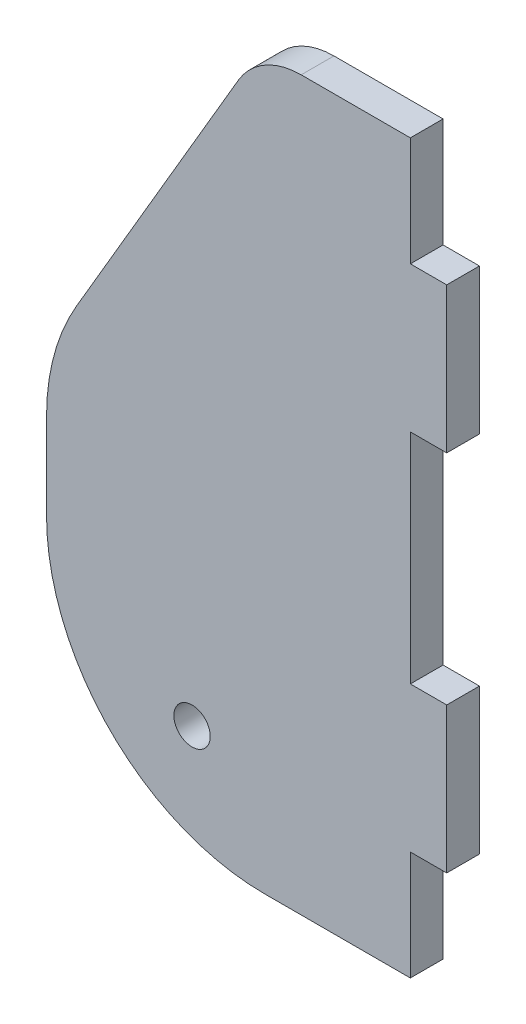
from build123d import *

# Parameters (mm, degrees)
BOSS_EXTRUDE1_DEPTH = 4.5
FILLET1_R           = 10
BOSS_EXTRUDE2_DEPTH = 4.5
FILLET2_R           = 30
SKETCH3_R           = 2.5
CUT_EXTRUDE1_DEPTH  = 5


with BuildPart() as part:
    # Sketch1 → Boss-Extrude1 (new body)
    with BuildSketch(Plane.XY):
        Polygon((10, -15), (10, 0), (10, 15), (15, 15), (15, 35), (10, 35), (10, 50), (-15, 50), (-15, -50), (10, -50), (10, -35), (15, -35), (15, -15), align=None)
    extrude(amount=BOSS_EXTRUDE1_DEPTH)

    # Fillet1
    fillet1_edges = [part.edges().sort_by_distance(p)[0] for p in [
        (-15, -50, 2.25),
        (-15, 50, 2.25),
    ]]
    fillet(fillet1_edges, radius=FILLET1_R)

    # Sketch2 → Boss-Extrude2 (add)
    with BuildSketch(Plane.XY.offset(4.5)):
        with BuildLine():
            Line((-40, 0), (-13.630305493, 45.051517306))
            ThreePointArc((-13.630305493, 45.051517306), (-14.651503897, 42.616958642), (-15, 40))
            Line((-15, 40), (-15, -40))
            ThreePointArc((-15, -40), (-12.071067812, -47.071067812), (-5, -50))
            Line((-5, -50), (-40, -50))
            Line((-40, -50), (-40, 0))
        make_face()
    extrude(amount=-BOSS_EXTRUDE2_DEPTH)

    # Fillet2
    fillet2_edges = [part.edges().sort_by_distance(p)[0] for p in [
        (-40, -50, 2.25),
        (-40, 0, 2.25),
    ]]
    fillet(fillet2_edges, radius=FILLET2_R)

    # Sketch3 → Cut-Extrude1 (cut)
    with BuildSketch(Plane.XY.offset(4.5)):
        with Locations((-20, -35)):
            Circle(SKETCH3_R)
    extrude(amount=-CUT_EXTRUDE1_DEPTH, mode=Mode.SUBTRACT)


solid = part.part
